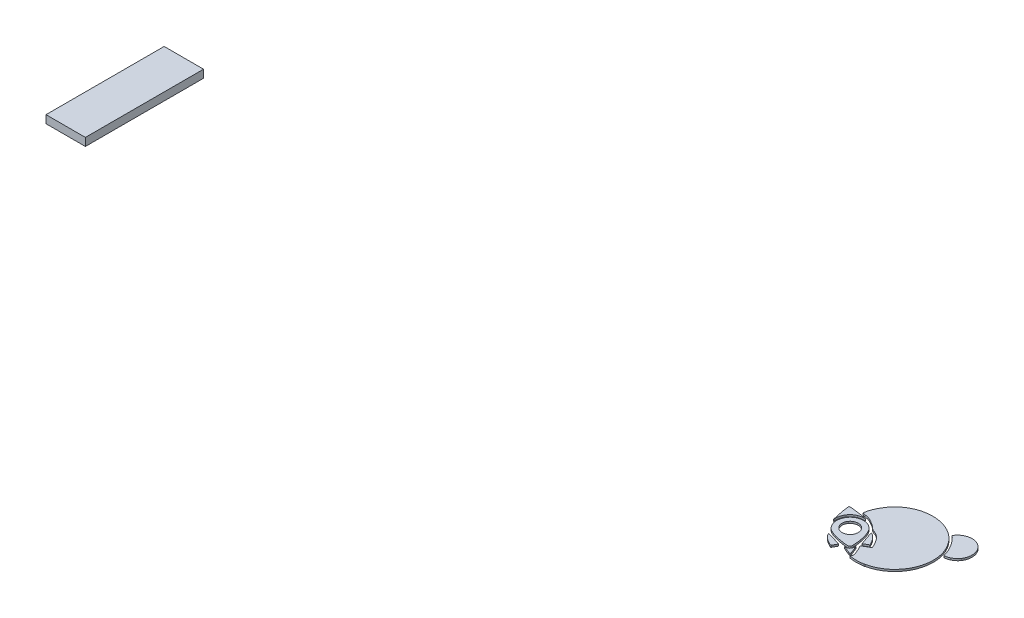
from build123d import *

# Parameters (mm, degrees)
SALIENTE_EXTRUIR1_DEPTH    = 0.3
SALIENTE_EXTRUIR1_2_DEPTH  = 0.3
SALIENTE_EXTRUIR1_3_DEPTH  = 0.3
SALIENTE_EXTRUIR1_4_DEPTH  = 0.3
SALIENTE_EXTRUIR1_5_DEPTH  = 0.3
SALIENTE_EXTRUIR1_6_DEPTH  = 0.3
SALIENTE_EXTRUIR1_7_DEPTH  = 0.3
SALIENTE_EXTRUIR1_8_DEPTH  = 0.3
SALIENTE_EXTRUIR1_9_DEPTH  = 0.3
SALIENTE_EXTRUIR1_10_DEPTH = 0.3
SALIENTE_EXTRUIR1_11_DEPTH = 0.3
SALIENTE_EXTRUIR1_12_DEPTH = 0.3
SALIENTE_EXTRUIR1_13_DEPTH = 0.3
SALIENTE_EXTRUIR1_14_DEPTH = 0.3
SALIENTE_EXTRUIR1_15_DEPTH = 0.3
SALIENTE_EXTRUIR1_16_DEPTH = 0.3
SALIENTE_EXTRUIR1_17_DEPTH = 0.3
SALIENTE_EXTRUIR1_18_DEPTH = 0.3
CROQUIS3_W                 = 32.379620454
CROQUIS3_H                 = 8.703750059
CORTAR_EXTRUIR2_DEPTH      = 10
SALIENTE_EXTRUIR2_DEPTH    = 0.3
ESCALA2_SCALE              = 0.8
CROQUIS6_W                 = 5
CROQUIS6_H                 = 15
SALIENTE_EXTRUIR3_DEPTH    = 1


with BuildPart() as part:
    # Croquis1 → Saliente-Extruir1 (new body)
    with BuildSketch(Plane(origin=(0, 0, 0), x_dir=(1, 0, 0), z_dir=(0, 1, 0))):
        with BuildLine():
            Line((3.578406282, 3.929124777), (1.831381085, 3.929124777))
            add(Edge.make_bspline(
                [(1.831381085, 3.929124777), (2.195955538, 4.293699449), (2.561850832, 4.656953063), (2.925104228, 5.022805122)],
                knots=[0, 0, 0, 0, 1, 1, 1, 1], degree=3))
            add(Edge.make_bspline(
                [(2.925104228, 5.022805122), (3.050477873, 5.149089533), (3.225876383, 5.406839742), (3.393761239, 5.468737315)],
                knots=[0, 0, 0, 0, 1, 1, 1, 1], degree=3))
            add(Edge.make_bspline(
                [(3.393761239, 5.468737315), (3.539659104, 5.52252512), (3.778106582, 5.477296898), (3.933492482, 5.477296898)],
                knots=[0, 0, 0, 0, 1, 1, 1, 1], degree=3))
            Line((3.933492482, 5.477296898), (5.154989666, 5.477296898))
            Line((5.154989666, 5.477296898), (5.154989666, 2.480368276))
            Line((5.154989666, 2.480368276), (5.169193769, 2.480368276))
            add(Edge.make_bspline(
                [(5.169193769, 2.480368276), (5.184873963, 2.677469913), (5.263674964, 2.886373947), (5.350372835, 3.062709863)],
                knots=[0, 0, 0, 0, 1, 1, 1, 1], degree=3))
            add(Edge.make_bspline(
                [(5.350372835, 3.062709863), (5.429102652, 3.222826461), (5.527291326, 3.374887662), (5.652324117, 3.503017188)],
                knots=[0, 0, 0, 0, 1, 1, 1, 1], degree=3))
            add(Edge.make_bspline(
                [(5.652324117, 3.503017188), (6.163520725, 4.026898354), (6.976569044, 4.092033938), (7.66900171, 4.026131922)],
                knots=[0, 0, 0, 0, 1, 1, 1, 1], degree=3))
            add(Edge.make_bspline(
                [(7.66900171, 4.026131922), (7.927561368, 4.001529673), (8.175738383, 3.943324513), (8.435988121, 3.943324513)],
                knots=[0, 0, 0, 0, 1, 1, 1, 1], degree=3))
            add(Edge.make_bspline(
                [(8.435988121, 3.943324513), (8.421102745, 4.664846657), (8.194841973, 5.406920534), (7.900603268, 6.059638484)],
                knots=[0, 0, 0, 0, 1, 1, 1, 1], degree=3))
            add(Edge.make_bspline(
                [(7.900603268, 6.059638484), (7.603907177, 6.717756614), (7.184706429, 7.310922142), (6.674759913, 7.820867784)],
                knots=[0, 0, 0, 0, 1, 1, 1, 1], degree=3))
            add(Edge.make_bspline(
                [(6.674759913, 7.820867784), (4.340535784, 10.155095188), (0.329636401, 10.188178411), (-1.988793551, 7.792404989)],
                knots=[0, 0, 0, 0, 1, 1, 1, 1], degree=3))
            add(Edge.make_bspline(
                [(-1.988793551, 7.792404989), (-2.582355833, 7.179041248), (-3.048016117, 6.446839277), (-3.346856689, 5.647739365)],
                knots=[0, 0, 0, 0, 1, 1, 1, 1], degree=3))
            add(Edge.make_bspline(
                [(-3.346856689, 5.647739365), (-3.449590458, 5.373001005), (-3.543901117, 5.085311909), (-3.59318728, 4.79553314)],
                knots=[0, 0, 0, 0, 1, 1, 1, 1], degree=3))
            add(Edge.make_bspline(
                [(-3.59318728, 4.79553314), (-3.604421732, 4.72948679), (-3.66630664, 4.565535848), (-3.622290079, 4.507599266)],
                knots=[0, 0, 0, 0, 1, 1, 1, 1], degree=3))
            add(Edge.make_bspline(
                [(-3.622290079, 4.507599266), (-3.566200576, 4.433755617), (-3.326460645, 4.433897549), (-3.239251383, 4.417564468)],
                knots=[0, 0, 0, 0, 1, 1, 1, 1], degree=3))
            add(Edge.make_bspline(
                [(-3.239251383, 4.417564468), (-2.921363774, 4.357994578), (-2.57941566, 4.304986306), (-2.28761993, 4.159089096)],
                knots=[0, 0, 0, 0, 1, 1, 1, 1], degree=3))
            add(Edge.make_bspline(
                [(-2.28761993, 4.159089096), (-1.838094895, 3.934334767), (-1.38344219, 3.663913319), (-0.980902058, 3.362474084)],
                knots=[0, 0, 0, 0, 1, 1, 1, 1], degree=3))
            add(Edge.make_bspline(
                [(-0.980902058, 3.362474084), (-0.821809334, 3.243336705), (-0.708252716, 3.076018703), (-0.540594951, 2.969478104)],
                knots=[0, 0, 0, 0, 1, 1, 1, 1], degree=3))
            add(Edge.make_bspline(
                [(-0.540594951, 2.969478104), (-0.333579702, 2.837927147), (-0.07820172, 2.799577161), (0.141170772, 2.689898776)],
                knots=[0, 0, 0, 0, 1, 1, 1, 1], degree=3))
            add(Edge.make_bspline(
                [(0.141170772, 2.689898776), (0.511298691, 2.504826409), (0.835989639, 2.197777591), (1.084322779, 1.869620448)],
                knots=[0, 0, 0, 0, 1, 1, 1, 1], degree=3))
            add(Edge.make_bspline(
                [(1.084322779, 1.869620448), (1.33001424, 1.544943912), (1.540693951, 1.189459429), (1.707897098, 0.81856333)],
                knots=[0, 0, 0, 0, 1, 1, 1, 1], degree=3))
            add(Edge.make_bspline(
                [(1.707897098, 0.81856333), (1.743135938, 0.740374165), (1.885795355, 0.518871167), (1.824251739, 0.44045491)],
                knots=[0, 0, 0, 0, 1, 1, 1, 1], degree=3))
            add(Edge.make_bspline(
                [(1.824251739, 0.44045491), (1.764753469, 0.3646502), (1.629991141, 0.314227271), (1.54731278, 0.266761111)],
                knots=[0, 0, 0, 0, 1, 1, 1, 1], degree=3))
            add(Edge.make_bspline(
                [(1.54731278, 0.266761111), (1.356759223, 0.157364406), (1.168165855, 0.044375734), (0.979174641, -0.06768929)],
                knots=[0, 0, 0, 0, 1, 1, 1, 1], degree=3))
            add(Edge.make_bspline(
                [(0.979174641, -0.06768929), (0.905629267, -0.111292938), (0.712476174, -0.17778015), (0.702647503, -0.275315719)],
                knots=[0, 0, 0, 0, 1, 1, 1, 1], degree=3))
            add(Edge.make_bspline(
                [(0.702647503, -0.275315719), (0.693756018, -0.363531824), (0.792825324, -0.48487264), (0.832751191, -0.559170471)],
                knots=[0, 0, 0, 0, 1, 1, 1, 1], degree=3))
            add(Edge.make_bspline(
                [(0.832751191, -0.559170471), (0.941933251, -0.762395048), (1.029199287, -0.984238683), (1.114831795, -1.198326505)],
                knots=[0, 0, 0, 0, 1, 1, 1, 1], degree=3))
            add(Edge.make_bspline(
                [(1.114831795, -1.198326505), (1.212949285, -1.443619465), (1.394554802, -1.782002251), (1.387396196, -2.050532731)],
                knots=[0, 0, 0, 0, 1, 1, 1, 1], degree=3))
            add(Edge.make_bspline(
                [(1.387396196, -2.050532731), (1.383277989, -2.204755882), (1.259564946, -2.307446852), (1.249039498, -2.448225563)],
                knots=[0, 0, 0, 0, 1, 1, 1, 1], degree=3))
            add(Edge.make_bspline(
                [(1.249039498, -2.448225563), (1.825884173, -2.555320788), (2.428281167, -2.569708311), (3.010267706, -2.507398044)],
                knots=[0, 0, 0, 0, 1, 1, 1, 1], degree=3))
            add(Edge.make_bspline(
                [(3.010267706, -2.507398044), (3.148538372, -2.49259346), (3.284877454, -2.477129439), (3.422167917, -2.454105909)],
                knots=[0, 0, 0, 0, 1, 1, 1, 1], degree=3))
            add(Edge.make_bspline(
                [(3.422167917, -2.454105909), (3.463372044, -2.447184002), (3.535980231, -2.44794825), (3.563804769, -2.411454295)],
                knots=[0, 0, 0, 0, 1, 1, 1, 1], degree=3))
            add(Edge.make_bspline(
                [(3.563804769, -2.411454295), (3.6257744, -2.330182151), (3.578406282, -2.066466219), (3.578406282, -1.965308331)],
                knots=[0, 0, 0, 0, 1, 1, 1, 1], degree=3))
            add(Edge.make_bspline(
                [(3.578406282, -1.965308331), (3.578406282, -1.558223977), (3.582638034, -1.150556611), (3.578463054, -0.74381071)],
                knots=[0, 0, 0, 0, 1, 1, 1, 1], degree=3))
            add(Edge.make_bspline(
                [(3.578463054, -0.74381071), (3.562442224, 0.813455967), (3.578406282, 2.371759839), (3.578406282, 3.929124777)],
                knots=[0, 0, 0, 0, 1, 1, 1, 1], degree=3))
        make_face()
    extrude(amount=SALIENTE_EXTRUIR1_DEPTH)


with BuildPart() as body_2:
    # Croquis1 → Saliente-Extruir1 2 (new body)
    with BuildSketch(Plane(origin=(0, 0, 0), x_dir=(1, 0, 0), z_dir=(0, 1, 0))):
        with BuildLine():
            Line((3.038675476, 4.426241963), (4.075527835, 4.426241963))
            Line((4.075527835, 4.426241963), (4.075527835, -0.829037512))
            Line((4.075527835, -0.829037512), (4.075527835, -2.078940937))
            add(Edge.make_bspline(
                [(4.075527835, -2.078940937), (4.075527835, -2.159346423), (4.032391907, -2.438244478), (4.098295888, -2.490442647)],
                knots=[0, 0, 0, 0, 1, 1, 1, 1], degree=3))
            add(Edge.make_bspline(
                [(4.098295888, -2.490442647), (4.135480505, -2.519901148), (4.215829437, -2.50505071), (4.260172659, -2.50505071)],
                knots=[0, 0, 0, 0, 1, 1, 1, 1], degree=3))
            Line((4.260172659, -2.50505071), (4.657869422, -2.50505071))
            Line((4.657869422, -2.50505071), (4.657869422, 4.980170977))
            Line((4.657869422, 4.980170977), (3.919289689, 4.980170977))
            Line((3.919289689, 4.980170977), (3.592610385, 4.971611394))
            Line((3.592610385, 4.971611394), (3.407965342, 4.809735059))
            Line((3.407965342, 4.809735059), (3.038675476, 4.426241963))
        make_face()
    extrude(amount=SALIENTE_EXTRUIR1_2_DEPTH)


with BuildPart() as body_3:
    # Croquis1 → Saliente-Extruir1 3 (new body)
    with BuildSketch(Plane(origin=(0, 0, 0), x_dir=(1, 0, 0), z_dir=(0, 1, 0))):
        with BuildLine():
            Line((18.63406794, 4.809735059), (18.63406794, 0.733343079))
            add(Edge.make_bspline(
                [(18.63406794, 0.733343079), (18.63406794, 0.008298841), (18.545581291, -0.783842043), (18.690882169, -1.49659935)],
                knots=[0, 0, 0, 0, 1, 1, 1, 1], degree=3))
            add(Edge.make_bspline(
                [(18.690882169, -1.49659935), (18.793005412, -1.996943849), (19.118832688, -2.395706629), (19.642512967, -2.474734066)],
                knots=[0, 0, 0, 0, 1, 1, 1, 1], degree=3))
            add(Edge.make_bspline(
                [(19.642512967, -2.474734066), (19.723756943, -2.486983876), (20.010524574, -2.555111166), (20.068190393, -2.482267372)],
                knots=[0, 0, 0, 0, 1, 1, 1, 1], degree=3))
            add(Edge.make_bspline(
                [(20.068190393, -2.482267372), (20.095744825, -2.44748315), (20.082820292, -2.375925696), (20.082820292, -2.33459514)],
                knots=[0, 0, 0, 0, 1, 1, 1, 1], degree=3))
            Line((20.082820292, -2.33459514), (20.082820292, -1.936897941))
            add(Edge.make_bspline(
                [(20.082820292, -1.936897941), (19.934820307, -1.936897941), (19.784263365, -1.944016369), (19.642512967, -1.893008245)],
                knots=[0, 0, 0, 0, 1, 1, 1, 1], degree=3))
            add(Edge.make_bspline(
                [(19.642512967, -1.893008245), (19.174367347, -1.724498016), (19.216409745, -1.115468873), (19.216409745, -0.71540032)],
                knots=[0, 0, 0, 0, 1, 1, 1, 1], degree=3))
            Line((19.216409745, -0.71540032), (19.216409745, 2.878074209))
            Line((19.216409745, 2.878074209), (20.082820292, 2.878074209))
            Line((20.082820292, 2.878074209), (20.082820292, 3.275771409))
            Line((20.082820292, 3.275771409), (20.068190393, 3.42344364))
            Line((20.068190393, 3.42344364), (19.855565561, 3.446211693))
            Line((19.855565561, 3.446211693), (19.216409745, 3.446211693))
            Line((19.216409745, 3.446211693), (19.216409745, 4.809743794))
            Line((19.216409745, 4.809743794), (18.63406794, 4.809735059))
        make_face()
    extrude(amount=SALIENTE_EXTRUIR1_3_DEPTH)


with BuildPart() as body_4:
    # Croquis1 → Saliente-Extruir1 4 (new body)
    with BuildSketch(Plane(origin=(0, 0, 0), x_dir=(1, 0, 0), z_dir=(0, 1, 0))):
        with BuildLine():
            Line((23.889347415, 4.809743794), (23.889347415, 0.804370145))
            add(Edge.make_bspline(
                [(23.889347415, 0.804370145), (23.889347415, 0.086455253), (23.82088604, -0.67162417), (23.921871645, -1.382962158)],
                knots=[0, 0, 0, 0, 1, 1, 1, 1], degree=3))
            add(Edge.make_bspline(
                [(23.921871645, -1.382962158), (23.977408269, -1.775148035), (24.15892819, -2.172987166), (24.528501047, -2.357745317)],
                knots=[0, 0, 0, 0, 1, 1, 1, 1], degree=3))
            add(Edge.make_bspline(
                [(24.528501047, -2.357745317), (24.773512327, -2.480265041), (25.054172739, -2.505035425), (25.323895446, -2.505035425)],
                knots=[0, 0, 0, 0, 1, 1, 1, 1], degree=3))
            Line((25.323895446, -2.505035425), (25.323895446, -1.936897941))
            add(Edge.make_bspline(
                [(25.323895446, -1.936897941), (25.180439464, -1.936897941), (25.035138586, -1.942444201), (24.897792224, -1.893008245)],
                knots=[0, 0, 0, 0, 1, 1, 1, 1], degree=3))
            add(Edge.make_bspline(
                [(24.897792224, -1.893008245), (24.430356263, -1.724753493), (24.471689002, -1.129629305), (24.471689002, -0.729604423)],
                knots=[0, 0, 0, 0, 1, 1, 1, 1], degree=3))
            Line((24.471689002, -0.729604423), (24.471689002, 2.878074209))
            Line((24.471689002, 2.878074209), (25.323895446, 2.878074209))
            Line((25.323895446, 2.878074209), (25.323895446, 3.446211693))
            Line((25.323895446, 3.446211693), (24.471689002, 3.446211693))
            Line((24.471689002, 3.446211693), (24.471689002, 4.809743794))
            Line((24.471689002, 4.809743794), (23.889347415, 4.809743794))
        make_face()
    extrude(amount=SALIENTE_EXTRUIR1_4_DEPTH)


with BuildPart() as body_5:
    # Croquis1 → Saliente-Extruir1 5 (new body)
    with BuildSketch(Plane(origin=(0, 0, 0), x_dir=(1, 0, 0), z_dir=(0, 1, 0))):
        with BuildLine():
            Line((-5.099902854, 1.301487332), (-5.085700498, 1.301487332))
            add(Edge.make_bspline(
                [(-5.085700498, 1.301487332), (-5.211824417, 2.29946412), (-4.694224936, 3.292242054), (-3.750575948, 3.695806498)],
                knots=[0, 0, 0, 0, 1, 1, 1, 1], degree=3))
            add(Edge.make_bspline(
                [(-3.750575948, 3.695806498), (-3.393032361, 3.848706189), (-3.039678822, 3.872312731), (-2.656910015, 3.872312731)],
                knots=[0, 0, 0, 0, 1, 1, 1, 1], degree=3))
            add(Edge.make_bspline(
                [(-2.656910015, 3.872312731), (-2.840816138, 3.970813437), (-3.106577199, 3.987814689), (-3.310268841, 4.028549131)],
                knots=[0, 0, 0, 0, 1, 1, 1, 1], degree=3))
            add(Edge.make_bspline(
                [(-3.310268841, 4.028549131), (-3.835541159, 4.133585034), (-4.368431941, 4.201845521), (-4.901055892, 4.253390803)],
                knots=[0, 0, 0, 0, 1, 1, 1, 1], degree=3))
            add(Edge.make_bspline(
                [(-4.901055892, 4.253390803), (-5.071193097, 4.269854897), (-5.242778007, 4.274418552), (-5.412380238, 4.29436762)],
                knots=[0, 0, 0, 0, 1, 1, 1, 1], degree=3))
            add(Edge.make_bspline(
                [(-5.412380238, 4.29436762), (-5.478458687, 4.302141119), (-5.569636801, 4.304346521), (-5.608685965, 4.238562199)],
                knots=[0, 0, 0, 0, 1, 1, 1, 1], degree=3))
            add(Edge.make_bspline(
                [(-5.608685965, 4.238562199), (-5.647504108, 4.173168736), (-5.621132297, 4.070648302), (-5.613583706, 4.000143108)],
                knots=[0, 0, 0, 0, 1, 1, 1, 1], degree=3))
            add(Edge.make_bspline(
                [(-5.613583706, 4.000143108), (-5.593783121, 3.815199354), (-5.573445815, 3.630312591), (-5.546194026, 3.446207326)],
                knots=[0, 0, 0, 0, 1, 1, 1, 1], degree=3))
            add(Edge.make_bspline(
                [(-5.546194026, 3.446207326), (-5.438327346, 2.717470676), (-5.248563586, 2.019812734), (-5.099902854, 1.301487332)],
                knots=[0, 0, 0, 0, 1, 1, 1, 1], degree=3))
        make_face()
    extrude(amount=SALIENTE_EXTRUIR1_5_DEPTH)


with BuildPart() as body_6:
    # Croquis1 → Saliente-Extruir1 6 (new body)
    with BuildSketch(Plane(origin=(0, 0, 0), x_dir=(1, 0, 0), z_dir=(0, 1, 0))):
        with BuildLine():
            Line((5.595298301, -2.505039792), (6.16343644, -2.505039792))
            add(Edge.make_bspline(
                [(6.16343644, -2.505039792), (6.16343644, -1.089766107), (6.146662278, 0.326632115), (6.163493212, 1.741792473)],
                knots=[0, 0, 0, 0, 1, 1, 1, 1], degree=3))
            add(Edge.make_bspline(
                [(6.163493212, 1.741792473), (6.16898925, 2.204612155), (6.291054574, 2.919302137), (6.873609058, 2.962012489)],
                knots=[0, 0, 0, 0, 1, 1, 1, 1], degree=3))
            add(Edge.make_bspline(
                [(6.873609058, 2.962012489), (7.500237313, 3.007946003), (7.726938511, 2.380834743), (7.739806707, 1.855420712)],
                knots=[0, 0, 0, 0, 1, 1, 1, 1], degree=3))
            add(Edge.make_bspline(
                [(7.739806707, 1.855420712), (7.775372209, 0.403899816), (7.740019824, -1.053034143), (7.740019824, -2.505039792)],
                knots=[0, 0, 0, 0, 1, 1, 1, 1], degree=3))
            Line((7.740019824, -2.505039792), (8.308157962, -2.505039792))
            Line((8.308157962, -2.505039792), (8.308157962, 1.585556074))
            add(Edge.make_bspline(
                [(8.308157962, 1.585556074), (8.308157962, 2.198775481), (8.285290557, 2.929117271), (7.725816376, 3.317822541)],
                knots=[0, 0, 0, 0, 1, 1, 1, 1], degree=3))
            add(Edge.make_bspline(
                [(7.725816376, 3.317822541), (6.987364599, 3.830866447), (5.919236355, 3.435754591), (5.693074717, 2.579796779)],
                knots=[0, 0, 0, 0, 1, 1, 1, 1], degree=3))
            add(Edge.make_bspline(
                [(5.693074717, 2.579796779), (5.531340096, 1.967656054), (5.595298301, 1.304312867), (5.595298301, 0.676533217)],
                knots=[0, 0, 0, 0, 1, 1, 1, 1], degree=3))
            Line((5.595298301, 0.676533217), (5.595298301, -2.505039792))
        make_face()
    extrude(amount=SALIENTE_EXTRUIR1_6_DEPTH)


with BuildPart() as body_7:
    # Croquis1 → Saliente-Extruir1 7 (new body)
    with BuildSketch(Plane(origin=(0, 0, 0), x_dir=(1, 0, 0), z_dir=(0, 1, 0))):
        with BuildLine():
            Line((12.824857486, 0.026684474), (13.946930752, 0.587804192))
            add(Edge.make_bspline(
                [(13.946930752, 0.587804192), (14.084702691, 0.656719531), (14.333548533, 0.726146042), (14.435529626, 0.841820502)],
                knots=[0, 0, 0, 0, 1, 1, 1, 1], degree=3))
            add(Edge.make_bspline(
                [(14.435529626, 0.841820502), (14.511517756, 0.92800589), (14.458254007, 1.23161974), (14.458254007, 1.344097457)],
                knots=[0, 0, 0, 0, 1, 1, 1, 1], degree=3))
            add(Edge.make_bspline(
                [(14.458254007, 1.344097457), (14.458254007, 1.85390095), (14.475875392, 2.394938402), (14.24136707, 2.863865739)],
                knots=[0, 0, 0, 0, 1, 1, 1, 1], degree=3))
            add(Edge.make_bspline(
                [(14.24136707, 2.863865739), (13.81668535, 3.713218043), (12.481275627, 3.769278941), (11.993244699, 2.949087956)],
                knots=[0, 0, 0, 0, 1, 1, 1, 1], degree=3))
            add(Edge.make_bspline(
                [(11.993244699, 2.949087956), (11.716845518, 2.484464647), (11.731191116, 1.922006403), (11.731191116, 1.400909503)],
                knots=[0, 0, 0, 0, 1, 1, 1, 1], degree=3))
            Line((11.731191116, 1.400909503), (11.731191116, -0.317707488))
            add(Edge.make_bspline(
                [(11.731191116, -0.317707488), (11.731191116, -0.761381873), (11.713720397, -1.207525873), (11.836722689, -1.638629463)],
                knots=[0, 0, 0, 0, 1, 1, 1, 1], degree=3))
            add(Edge.make_bspline(
                [(11.836722689, -1.638629463), (12.044377286, -2.366612783), (12.738927575, -2.726073541), (13.464013302, -2.549099806)],
                knots=[0, 0, 0, 0, 1, 1, 1, 1], degree=3))
            add(Edge.make_bspline(
                [(13.464013302, -2.549099806), (14.070642704, -2.40101488), (14.362950262, -1.832578029), (14.432121078, -1.255136367)],
                knots=[0, 0, 0, 0, 1, 1, 1, 1], degree=3))
            add(Edge.make_bspline(
                [(14.432121078, -1.255136367), (14.44718769, -1.128341001), (14.458254007, -0.999445043), (14.458254007, -0.871643271)],
                knots=[0, 0, 0, 0, 1, 1, 1, 1], degree=3))
            add(Edge.make_bspline(
                [(14.458254007, -0.871643271), (14.458254007, -0.83447241), (14.468909814, -0.770670767), (14.435529626, -0.744208119)],
                knots=[0, 0, 0, 0, 1, 1, 1, 1], degree=3))
            add(Edge.make_bspline(
                [(14.435529626, -0.744208119), (14.398315312, -0.714751801), (14.317925111, -0.729600056), (14.27360962, -0.729600056)],
                knots=[0, 0, 0, 0, 1, 1, 1, 1], degree=3))
            Line((14.27360962, -0.729600056), (13.87591242, -0.729608791))
            add(Edge.make_bspline(
                [(13.87591242, -0.729608791), (13.87591242, -1.065532881), (13.873641511, -1.416089053), (13.683457196, -1.709645393)],
                knots=[0, 0, 0, 0, 1, 1, 1, 1], degree=3))
            add(Edge.make_bspline(
                [(13.683457196, -1.709645393), (13.441712532, -2.082814585), (12.907804426, -2.152679993), (12.598880141, -1.823217078)],
                knots=[0, 0, 0, 0, 1, 1, 1, 1], degree=3))
            add(Edge.make_bspline(
                [(12.598880141, -1.823217078), (12.443637483, -1.657619727), (12.374322333, -1.432210328), (12.338387372, -1.212526241)],
                knots=[0, 0, 0, 0, 1, 1, 1, 1], degree=3))
            add(Edge.make_bspline(
                [(12.338387372, -1.212526241), (12.300181501, -0.978480617), (12.313531829, -0.738755753), (12.313531829, -0.502351876)],
                knots=[0, 0, 0, 0, 1, 1, 1, 1], degree=3))
            add(Edge.make_bspline(
                [(12.313531829, -0.502351876), (12.313531829, -0.431023696), (12.288534355, -0.300110122), (12.328161728, -0.238026946)],
                knots=[0, 0, 0, 0, 1, 1, 1, 1], degree=3))
            add(Edge.make_bspline(
                [(12.328161728, -0.238026946), (12.403724063, -0.119511666), (12.699725998, -0.03591184), (12.824857486, 0.026684474)],
                knots=[0, 0, 0, 0, 1, 1, 1, 1], degree=3))
        make_face()
        with BuildLine():
            add(Edge.make_bspline(
                [(12.313529646, 0.435074601), (12.313529646, 0.940078832), (12.291934168, 1.450367076), (12.314184716, 1.954845067)],
                knots=[0, 0, 0, 0, 1, 1, 1, 1], degree=3))
            add(Edge.make_bspline(
                [(12.314184716, 1.954845067), (12.321718022, 2.127801038), (12.3607733, 2.30332685), (12.417871393, 2.466170723)],
                knots=[0, 0, 0, 0, 1, 1, 1, 1], degree=3))
            add(Edge.make_bspline(
                [(12.417871393, 2.466170723), (12.593851387, 2.967637357), (13.24848891, 3.155605352), (13.617780087, 2.736035362)],
                knots=[0, 0, 0, 0, 1, 1, 1, 1], degree=3))
            add(Edge.make_bspline(
                [(13.617780087, 2.736035362), (13.862363387, 2.458102444), (13.875997579, 2.03466754), (13.875997579, 1.684980428)],
                knots=[0, 0, 0, 0, 1, 1, 1, 1], degree=3))
            add(Edge.make_bspline(
                [(13.875997579, 1.684980428), (13.875997579, 1.573354301), (13.925710848, 1.303332446), (13.861367681, 1.211109495)],
                knots=[0, 0, 0, 0, 1, 1, 1, 1], degree=3))
            add(Edge.make_bspline(
                [(13.861367681, 1.211109495), (13.79219883, 1.111984289), (13.557415378, 1.046306962), (13.449894358, 0.992519376)],
                knots=[0, 0, 0, 0, 1, 1, 1, 1], degree=3))
            add(Edge.make_bspline(
                [(13.449894358, 0.992519376), (13.088699847, 0.81192092), (12.701230475, 0.546742216), (12.313529646, 0.435074601)],
                knots=[0, 0, 0, 0, 1, 1, 1, 1], degree=3))
        make_face(mode=Mode.SUBTRACT)
    extrude(amount=SALIENTE_EXTRUIR1_7_DEPTH)


with BuildPart() as body_8:
    # Croquis1 → Saliente-Extruir1 8 (new body)
    with BuildSketch(Plane(origin=(0, 0, 0), x_dir=(1, 0, 0), z_dir=(0, 1, 0))):
        with BuildLine():
            Line((17.298946448, -2.505031057), (17.725049669, -2.505031057))
            add(Edge.make_bspline(
                [(17.725049669, -2.505031057), (17.768227523, -2.505031057), (17.849329567, -2.519748299), (17.872765572, -2.472107235)],
                knots=[0, 0, 0, 0, 1, 1, 1, 1], degree=3))
            add(Edge.make_bspline(
                [(17.872765572, -2.472107235), (17.91906811, -2.377853785), (17.881281484, -2.183507592), (17.881281484, -2.078927836)],
                knots=[0, 0, 0, 0, 1, 1, 1, 1], degree=3))
            Line((17.881281484, -2.078927836), (17.881281484, -1.098889049))
            add(Edge.make_bspline(
                [(17.881281484, -1.098889049), (17.881281484, -0.073244284), (17.912528327, 0.959377196), (17.86763419, 1.983259824)],
                knots=[0, 0, 0, 0, 1, 1, 1, 1], degree=3))
            add(Edge.make_bspline(
                [(17.86763419, 1.983259824), (17.846038931, 2.477158432), (17.716793603, 3.045125598), (17.270520773, 3.331310216)],
                knots=[0, 0, 0, 0, 1, 1, 1, 1], degree=3))
            add(Edge.make_bspline(
                [(17.270520773, 3.331310216), (16.580090438, 3.774089339), (15.593376269, 3.492946577), (15.3023485, 2.721839993)],
                knots=[0, 0, 0, 0, 1, 1, 1, 1], degree=3))
            add(Edge.make_bspline(
                [(15.3023485, 2.721839993), (15.128355552, 2.261109767), (15.154206801, 1.756686583), (15.154206801, 1.27308786)],
                knots=[0, 0, 0, 0, 1, 1, 1, 1], degree=3))
            Line((15.154206801, 1.27308786), (15.154206801, -0.786412101))
            Line((15.154206801, -0.786412101), (15.154206801, -2.064723732))
            add(Edge.make_bspline(
                [(15.154206801, -2.064723732), (15.154206801, -2.147118448), (15.109749378, -2.43716798), (15.176931182, -2.490429545)],
                knots=[0, 0, 0, 0, 1, 1, 1, 1], degree=3))
            add(Edge.make_bspline(
                [(15.176931182, -2.490429545), (15.227353892, -2.530299294), (15.362713208, -2.505037608), (15.42407144, -2.505037608)],
                knots=[0, 0, 0, 0, 1, 1, 1, 1], degree=3))
            add(Edge.make_bspline(
                [(15.42407144, -2.505037608), (15.49366827, -2.505037608), (15.657293641, -2.535205769), (15.713821823, -2.490429545)],
                knots=[0, 0, 0, 0, 1, 1, 1, 1], degree=3))
            add(Edge.make_bspline(
                [(15.713821823, -2.490429545), (15.762541569, -2.451824081), (15.736548388, -2.305302589), (15.736548388, -2.249368338)],
                knots=[0, 0, 0, 0, 1, 1, 1, 1], degree=3))
            Line((15.736548388, -2.249368338), (15.736548388, -1.524992271))
            Line((15.736548388, -1.524992271), (15.736548388, 1.102647357))
            add(Edge.make_bspline(
                [(15.736548388, 1.102647357), (15.736548388, 1.566063371), (15.671637493, 2.0888069), (15.868783019, 2.522991503)],
                knots=[0, 0, 0, 0, 1, 1, 1, 1], degree=3))
            add(Edge.make_bspline(
                [(15.868783019, 2.522991503), (16.106263177, 3.045907315), (16.803368676, 3.121753513), (17.113288667, 2.622415639)],
                knots=[0, 0, 0, 0, 1, 1, 1, 1], degree=3))
            add(Edge.make_bspline(
                [(17.113288667, 2.622415639), (17.372360152, 2.205118743), (17.298928979, 1.641156239), (17.298928979, 1.173663505)],
                knots=[0, 0, 0, 0, 1, 1, 1, 1], degree=3))
            Line((17.298928979, 1.173663505), (17.298928979, -0.303494652))
            Line((17.298928979, -0.303494652), (17.298946448, -2.505031057))
        make_face()
    extrude(amount=SALIENTE_EXTRUIR1_8_DEPTH)


with BuildPart() as body_9:
    # Croquis1 → Saliente-Extruir1 9 (new body)
    with BuildSketch(Plane(origin=(0, 0, 0), x_dir=(1, 0, 0), z_dir=(0, 1, 0))):
        with BuildLine():
            Line((20.452096184, 1.244681837), (20.452096184, -0.331902857))
            add(Edge.make_bspline(
                [(20.452096184, -0.331902857), (20.452096184, -0.752311336), (20.43860174, -1.171141097), (20.542569879, -1.5818065)],
                knots=[0, 0, 0, 0, 1, 1, 1, 1], degree=3))
            add(Edge.make_bspline(
                [(20.542569879, -1.5818065), (20.726646757, -2.30814341), (21.344355578, -2.675102537), (22.071288602, -2.571985771)],
                knots=[0, 0, 0, 0, 1, 1, 1, 1], degree=3))
            add(Edge.make_bspline(
                [(22.071288602, -2.571985771), (22.63204148, -2.492460262), (22.974201838, -2.048517298), (23.102885989, -1.524992271)],
                knots=[0, 0, 0, 0, 1, 1, 1, 1], degree=3))
            add(Edge.make_bspline(
                [(23.102885989, -1.524992271), (23.27588323, -0.820316346), (23.179157983, -0.01610252), (23.179157983, 0.704950158)],
                knots=[0, 0, 0, 0, 1, 1, 1, 1], degree=3))
            add(Edge.make_bspline(
                [(23.179157983, 0.704950158), (23.179157983, 1.338538096), (23.257135125, 2.040159211), (23.056013541, 2.650823845)],
                knots=[0, 0, 0, 0, 1, 1, 1, 1], degree=3))
            add(Edge.make_bspline(
                [(23.056013541, 2.650823845), (22.860147584, 3.245266978), (22.301242222, 3.608832842), (21.673591402, 3.525416217)],
                knots=[0, 0, 0, 0, 1, 1, 1, 1], degree=3))
            add(Edge.make_bspline(
                [(21.673591402, 3.525416217), (21.175618476, 3.459212651), (20.793263018, 3.220153775), (20.605633476, 2.736044096)],
                knots=[0, 0, 0, 0, 1, 1, 1, 1], degree=3))
            add(Edge.make_bspline(
                [(20.605633476, 2.736044096), (20.422410591, 2.262898108), (20.452096184, 1.742440992), (20.452096184, 1.244681837)],
                knots=[0, 0, 0, 0, 1, 1, 1, 1], degree=3))
        make_face()
        with BuildLine():
            add(Edge.make_bspline(
                [(21.702102236, 2.959184769), (22.193542149, 3.023187301), (22.478178618, 2.654577397), (22.561979551, 2.210507786)],
                knots=[0, 0, 0, 0, 1, 1, 1, 1], degree=3))
            add(Edge.make_bspline(
                [(22.561979551, 2.210507786), (22.659840471, 1.691328057), (22.596918806, 1.118290431), (22.596918806, 0.591313184)],
                knots=[0, 0, 0, 0, 1, 1, 1, 1], degree=3))
            add(Edge.make_bspline(
                [(22.596918806, 0.591313184), (22.596918806, 0.055503191), (22.660833994, -0.525419077), (22.590957668, -1.056287658)],
                knots=[0, 0, 0, 0, 1, 1, 1, 1], degree=3))
            add(Edge.make_bspline(
                [(22.590957668, -1.056287658), (22.535706873, -1.475899135), (22.411143331, -1.967764843), (21.915157232, -2.032221338)],
                knots=[0, 0, 0, 0, 1, 1, 1, 1], degree=3))
            add(Edge.make_bspline(
                [(21.915157232, -2.032221338), (21.432239781, -2.094972686), (21.150869928, -1.71544058), (21.06948402, -1.283542171)],
                knots=[0, 0, 0, 0, 1, 1, 1, 1], degree=3))
            add(Edge.make_bspline(
                [(21.06948402, -1.283542171), (20.974035941, -0.777559921), (21.034542582, -0.220484169), (21.034542582, 0.293040121)],
                knots=[0, 0, 0, 0, 1, 1, 1, 1], degree=3))
            add(Edge.make_bspline(
                [(21.034542582, 0.293040121), (21.034542582, 0.849362542), (20.97318435, 1.44532522), (21.038669523, 1.997455192)],
                knots=[0, 0, 0, 0, 1, 1, 1, 1], degree=3))
            add(Edge.make_bspline(
                [(21.038669523, 1.997455192), (21.086819358, 2.404428184), (21.22416572, 2.896918392), (21.702102236, 2.959184769)],
                knots=[0, 0, 0, 0, 1, 1, 1, 1], degree=3))
        make_face(mode=Mode.SUBTRACT)
    extrude(amount=SALIENTE_EXTRUIR1_9_DEPTH)


with BuildPart() as body_10:
    # Croquis1 → Saliente-Extruir1 10 (new body)
    with BuildSketch(Plane(origin=(0, 0, 0), x_dir=(1, 0, 0), z_dir=(0, 1, 0))):
        with BuildLine():
            Line((28.420233137, -0.729600056), (27.852095435, -0.729600056))
            add(Edge.make_bspline(
                [(27.852095435, -0.729600056), (27.852095435, -1.064928033), (27.846702025, -1.417615366), (27.657507084, -1.709636659)],
                knots=[0, 0, 0, 0, 1, 1, 1, 1], degree=3))
            add(Edge.make_bspline(
                [(27.657507084, -1.709636659), (27.395027268, -2.115033115), (26.823197155, -2.146352016), (26.524356582, -1.766450888)],
                knots=[0, 0, 0, 0, 1, 1, 1, 1], degree=3))
            add(Edge.make_bspline(
                [(26.524356582, -1.766450888), (26.218412867, -1.377546912), (26.28659016, -0.793698664), (26.289714844, -0.331902857)],
                knots=[0, 0, 0, 0, 1, 1, 1, 1], degree=3))
            add(Edge.make_bspline(
                [(26.289714844, -0.331902857), (26.291024984, -0.143052701), (26.637414911, -0.055007133), (26.786836398, 0.019675225)],
                knots=[0, 0, 0, 0, 1, 1, 1, 1], degree=3))
            Line((26.786836398, 0.019675225), (27.837891332, 0.545202801))
            add(Edge.make_bspline(
                [(27.837891332, 0.545202801), (28.013445748, 0.633008395), (28.211726512, 0.707563887), (28.37549185, 0.815678838)],
                knots=[0, 0, 0, 0, 1, 1, 1, 1], degree=3))
            add(Edge.make_bspline(
                [(28.37549185, 0.815678838), (28.43443724, 0.854596552), (28.420233137, 0.926750339), (28.420233137, 0.989019118)],
                knots=[0, 0, 0, 0, 1, 1, 1, 1], degree=3))
            Line((28.420233137, 0.989019118), (28.420233137, 1.457732247))
            add(Edge.make_bspline(
                [(28.420233137, 1.457732247), (28.420233137, 2.103777435), (28.433159853, 2.894269726), (27.837891332, 3.312136533)],
                knots=[0, 0, 0, 0, 1, 1, 1, 1], degree=3))
            add(Edge.make_bspline(
                [(27.837891332, 3.312136533), (27.405538741, 3.615649939), (26.700336576, 3.615280916), (26.275510741, 3.2968734)],
                knots=[0, 0, 0, 0, 1, 1, 1, 1], degree=3))
            add(Edge.make_bspline(
                [(26.275510741, 3.2968734), (26.063453854, 3.13789444), (25.926533288, 2.911760097), (25.838328319, 2.66501703)],
                knots=[0, 0, 0, 0, 1, 1, 1, 1], degree=3))
            add(Edge.make_bspline(
                [(25.838328319, 2.66501703), (25.682091919, 2.227893346), (25.707373257, 1.757843874), (25.707373257, 1.301487332)],
                knots=[0, 0, 0, 0, 1, 1, 1, 1], degree=3))
            Line((25.707373257, 1.301487332), (25.707373257, -0.644386356))
            add(Edge.make_bspline(
                [(25.707373257, -0.644386356), (25.707373257, -1.133994255), (25.726828839, -1.65746251), (26.010760016, -2.07893657)],
                knots=[0, 0, 0, 0, 1, 1, 1, 1], degree=3))
            add(Edge.make_bspline(
                [(26.010760016, -2.07893657), (26.442544879, -2.71989623), (27.526126227, -2.77463607), (28.032621834, -2.192562844)],
                knots=[0, 0, 0, 0, 1, 1, 1, 1], degree=3))
            add(Edge.make_bspline(
                [(28.032621834, -2.192562844), (28.385719678, -1.786786447), (28.430742645, -1.240733559), (28.420233137, -0.729600056)],
                knots=[0, 0, 0, 0, 1, 1, 1, 1], degree=3))
        make_face()
        with BuildLine():
            add(Edge.make_bspline(
                [(26.289828389, 0.435074601), (26.289828389, 0.949524942), (26.267955599, 1.469342273), (26.29048346, 1.983251089)],
                knots=[0, 0, 0, 0, 1, 1, 1, 1], degree=3))
            add(Edge.make_bspline(
                [(26.29048346, 1.983251089), (26.297732902, 2.147870202), (26.33394736, 2.327686723), (26.395731387, 2.480372643)],
                knots=[0, 0, 0, 0, 1, 1, 1, 1], degree=3))
            add(Edge.make_bspline(
                [(26.395731387, 2.480372643), (26.584780247, 2.947026669), (27.20973196, 3.166158531), (27.579872544, 2.750182693)],
                knots=[0, 0, 0, 0, 1, 1, 1, 1], degree=3))
            add(Edge.make_bspline(
                [(27.579872544, 2.750182693), (27.827724644, 2.471553216), (27.852296323, 2.052535669), (27.852296323, 1.699182347)],
                knots=[0, 0, 0, 0, 1, 1, 1, 1], degree=3))
            add(Edge.make_bspline(
                [(27.852296323, 1.699182347), (27.852296323, 1.584689197), (27.903712774, 1.305590254), (27.837666425, 1.211109495)],
                knots=[0, 0, 0, 0, 1, 1, 1, 1], degree=3))
            add(Edge.make_bspline(
                [(27.837666425, 1.211109495), (27.768495609, 1.111969004), (27.533711938, 1.046306962), (27.426193101, 0.992519376)],
                knots=[0, 0, 0, 0, 1, 1, 1, 1], degree=3))
            add(Edge.make_bspline(
                [(27.426193101, 0.992519376), (27.064998591, 0.81192092), (26.677527036, 0.546742216), (26.289828389, 0.435074601)],
                knots=[0, 0, 0, 0, 1, 1, 1, 1], degree=3))
        make_face(mode=Mode.SUBTRACT)
    extrude(amount=SALIENTE_EXTRUIR1_10_DEPTH)


with BuildPart() as body_11:
    # Croquis1 → Saliente-Extruir1 11 (new body)
    with BuildSketch(Plane(origin=(0, 0, 0), x_dir=(1, 0, 0), z_dir=(0, 1, 0))):
        with BuildLine():
            Line((31.687028581, -0.786420836), (31.118888914, -0.786420836))
            add(Edge.make_bspline(
                [(31.118888914, -0.786420836), (31.118888914, -1.098812625), (31.124719038, -1.452834118), (30.943334497, -1.723849496)],
                knots=[0, 0, 0, 0, 1, 1, 1, 1], degree=3))
            add(Edge.make_bspline(
                [(30.943334497, -1.723849496), (30.672190288, -2.129031963), (30.084166842, -2.117526749), (29.822115006, -1.709634475)],
                knots=[0, 0, 0, 0, 1, 1, 1, 1], degree=3))
            add(Edge.make_bspline(
                [(29.822115006, -1.709634475), (29.634911478, -1.418335943), (29.655932677, -1.01848138), (29.655932677, -0.686987747)],
                knots=[0, 0, 0, 0, 1, 1, 1, 1], degree=3))
            Line((29.655932677, -0.686987747), (29.655932677, 1.358310295))
            add(Edge.make_bspline(
                [(29.655932677, 1.358310295), (29.655932677, 1.729673676), (29.609914003, 2.157014981), (29.753369767, 2.508791767)],
                knots=[0, 0, 0, 0, 1, 1, 1, 1], degree=3))
            add(Edge.make_bspline(
                [(29.753369767, 2.508791767), (29.948665813, 2.987219586), (30.575890618, 3.142562906), (30.91251345, 2.707640257)],
                knots=[0, 0, 0, 0, 1, 1, 1, 1], degree=3))
            add(Edge.make_bspline(
                [(30.91251345, 2.707640257), (31.123860896, 2.434635649), (31.118888914, 2.05494851), (31.118888914, 1.727601471)],
                knots=[0, 0, 0, 0, 1, 1, 1, 1], degree=3))
            Line((31.118888914, 1.727601471), (31.687028581, 1.727601471))
            add(Edge.make_bspline(
                [(31.687028581, 1.727601471), (31.687028581, 2.224465146), (31.662882698, 2.7337448), (31.325692139, 3.133743479)],
                knots=[0, 0, 0, 0, 1, 1, 1, 1], degree=3))
            add(Edge.make_bspline(
                [(31.325692139, 3.133743479), (30.839082276, 3.711071596), (29.791575638, 3.656146371), (29.368313237, 3.034319125)],
                knots=[0, 0, 0, 0, 1, 1, 1, 1], degree=3))
            add(Edge.make_bspline(
                [(29.368313237, 3.034319125), (29.099584053, 2.639576292), (29.087794975, 2.158248696), (29.087794975, 1.699193265)],
                knots=[0, 0, 0, 0, 1, 1, 1, 1], degree=3))
            Line((29.087794975, 1.699193265), (29.087794975, -0.587563393))
            add(Edge.make_bspline(
                [(29.087794975, -0.587563393), (29.087794975, -1.091530429), (29.067203939, -1.621191497), (29.349707063, -2.064721549)],
                knots=[0, 0, 0, 0, 1, 1, 1, 1], degree=3))
            add(Edge.make_bspline(
                [(29.349707063, -2.064721549), (29.767145891, -2.720311108), (30.846325168, -2.779824225), (31.339610195, -2.178350006)],
                knots=[0, 0, 0, 0, 1, 1, 1, 1], degree=3))
            add(Edge.make_bspline(
                [(31.339610195, -2.178350006), (31.665721335, -1.780510875), (31.687028581, -1.275122337), (31.687028581, -0.786420836)],
                knots=[0, 0, 0, 0, 1, 1, 1, 1], degree=3))
        make_face()
    extrude(amount=SALIENTE_EXTRUIR1_11_DEPTH)


with BuildPart() as body_12:
    # Croquis1 → Saliente-Extruir1 12 (new body)
    with BuildSketch(Plane(origin=(0, 0, 0), x_dir=(1, 0, 0), z_dir=(0, 1, 0))):
        with BuildLine():
            Line((34.485108712, -2.235164235), (34.485108712, -2.505028874))
            Line((34.485108712, -2.505028874), (35.024840392, -2.505028874))
            Line((35.024840392, -2.505028874), (35.024840392, 0.065796526))
            Line((35.024840392, 0.065796526), (35.024840392, 1.869635733))
            add(Edge.make_bspline(
                [(35.024840392, 1.869635733), (35.024840392, 2.329472881), (34.925699901, 2.867427137), (34.582118042, 3.200698193)],
                knots=[0, 0, 0, 0, 1, 1, 1, 1], degree=3))
            add(Edge.make_bspline(
                [(34.582118042, 3.200698193), (34.039971337, 3.726467927), (32.973434913, 3.629314701), (32.576305441, 2.977504896)],
                knots=[0, 0, 0, 0, 1, 1, 1, 1], degree=3))
            add(Edge.make_bspline(
                [(32.576305441, 2.977504896), (32.308713896, 2.538162926), (32.311980512, 2.025048928), (32.311980512, 1.528752763)],
                knots=[0, 0, 0, 0, 1, 1, 1, 1], degree=3))
            Line((32.311980512, 1.528752763), (32.311980512, -0.402916822))
            add(Edge.make_bspline(
                [(32.311980512, -0.402916822), (32.311980512, -0.850525995), (32.284851876, -1.309622695), (32.44052033, -1.738042681)],
                knots=[0, 0, 0, 0, 1, 1, 1, 1], degree=3))
            add(Edge.make_bspline(
                [(32.44052033, -1.738042681), (32.528723333, -1.980567097), (32.670048154, -2.209013837), (32.880117995, -2.364073294)],
                knots=[0, 0, 0, 0, 1, 1, 1, 1], degree=3))
            add(Edge.make_bspline(
                [(32.880117995, -2.364073294), (33.361755876, -2.719487903), (34.070508521, -2.64949148), (34.485108712, -2.235164235)],
                knots=[0, 0, 0, 0, 1, 1, 1, 1], degree=3))
        make_face()
        with BuildLine():
            add(Edge.make_bspline(
                [(33.547880722, 2.959184769), (34.062189131, 3.026170053), (34.347677191, 2.631639026), (34.422246003, 2.167897879)],
                knots=[0, 0, 0, 0, 1, 1, 1, 1], degree=3))
            add(Edge.make_bspline(
                [(34.422246003, 2.167897879), (34.500365295, 1.682395085), (34.456901394, 1.167206698), (34.456901394, 0.676533217)],
                knots=[0, 0, 0, 0, 1, 1, 1, 1], degree=3))
            add(Edge.make_bspline(
                [(34.456901394, 0.676533217), (34.456901394, 0.08926332), (34.49596104, -0.514424817), (34.44028445, -1.098897784)],
                knots=[0, 0, 0, 0, 1, 1, 1, 1], degree=3))
            add(Edge.make_bspline(
                [(34.44028445, -1.098897784), (34.401366736, -1.507274809), (34.240300504, -1.971756404), (33.775135453, -2.032221338)],
                knots=[0, 0, 0, 0, 1, 1, 1, 1], degree=3))
            add(Edge.make_bspline(
                [(33.775135453, -2.032221338), (33.26182275, -2.098920575), (32.976760486, -1.686962499), (32.910572204, -1.226728161)],
                knots=[0, 0, 0, 0, 1, 1, 1, 1], degree=3))
            add(Edge.make_bspline(
                [(32.910572204, -1.226728161), (32.843106535, -0.757346642), (32.880318884, -0.265793184), (32.880318884, 0.207820088)],
                knots=[0, 0, 0, 0, 1, 1, 1, 1], degree=3))
            add(Edge.make_bspline(
                [(32.880318884, 0.207820088), (32.880318884, 0.816523879), (32.853048316, 1.433265379), (32.895800373, 2.040065318)],
                knots=[0, 0, 0, 0, 1, 1, 1, 1], degree=3))
            add(Edge.make_bspline(
                [(32.895800373, 2.040065318), (32.923354805, 2.431157227), (33.108995117, 2.902001736), (33.547880722, 2.959184769)],
                knots=[0, 0, 0, 0, 1, 1, 1, 1], degree=3))
        make_face(mode=Mode.SUBTRACT)
    extrude(amount=SALIENTE_EXTRUIR1_12_DEPTH)


with BuildPart() as body_13:
    # Croquis1 → Saliente-Extruir1 13 (new body)
    with BuildSketch(Plane(origin=(0, 0, 0), x_dir=(1, 0, 0), z_dir=(0, 1, 0))):
        with BuildLine():
            Line((8.663242852, 3.446207326), (8.770904713, 2.821255614))
            Line((8.770904713, 2.821255614), (9.049576769, 1.358299377))
            Line((9.049576769, 1.358299377), (9.785315682, -2.505039792))
            add(Edge.make_bspline(
                [(9.785315682, -2.505039792), (9.892409597, -2.505039792), (10.174348269, -2.555689811), (10.259852821, -2.490431729)],
                knots=[0, 0, 0, 0, 1, 1, 1, 1], degree=3))
            add(Edge.make_bspline(
                [(10.259852821, -2.490431729), (10.326609267, -2.439554619), (10.331722307, -2.215780711), (10.347772398, -2.135744248)],
                knots=[0, 0, 0, 0, 1, 1, 1, 1], degree=3))
            add(Edge.make_bspline(
                [(10.347772398, -2.135744248), (10.413818529, -1.804746285), (10.47702384, -1.472953504), (10.540939465, -1.141501359)],
                knots=[0, 0, 0, 0, 1, 1, 1, 1], degree=3))
            Line((10.540939465, -1.141501359), (11.131803077, 1.912241492))
            add(Edge.make_bspline(
                [(11.131803077, 1.912241492), (11.19401421, 2.234247526), (11.255941261, 2.556338938), (11.319288722, 2.878076393)],
                knots=[0, 0, 0, 0, 1, 1, 1, 1], degree=3))
            add(Edge.make_bspline(
                [(11.319288722, 2.878076393), (11.355791629, 3.063487212), (11.414735709, 3.256741623), (11.418712858, 3.446213877)],
                knots=[0, 0, 0, 0, 1, 1, 1, 1], degree=3))
            Line((11.418712858, 3.446213877), (10.850574719, 3.446213877))
            add(Edge.make_bspline(
                [(10.850574719, 3.446213877), (10.657975816, 2.453379388), (10.470206089, 1.458754157), (10.290674305, 0.463489358)],
                knots=[0, 0, 0, 0, 1, 1, 1, 1], degree=3))
            add(Edge.make_bspline(
                [(10.290674305, 0.463489358), (10.206163931, -0.004898638), (10.042256006, -0.508354501), (10.040977746, -0.985262776)],
                knots=[0, 0, 0, 0, 1, 1, 1, 1], degree=3))
            Line((10.040977746, -0.985262776), (10.026773643, -0.985262776))
            Line((10.026773643, -0.985262776), (9.245584221, 3.446207326))
            Line((9.245584221, 3.446207326), (8.663242852, 3.446207326))
        make_face()
    extrude(amount=SALIENTE_EXTRUIR1_13_DEPTH)


with BuildPart() as body_14:
    # Croquis1 → Saliente-Extruir1 14 (new body)
    with BuildSketch(Plane(origin=(0, 0, 0), x_dir=(1, 0, 0), z_dir=(0, 1, 0))):
        with BuildLine():
            Line((-0.227934584, 2.409356495), (-0.00540924, 1.684980428))
            Line((-0.00540924, 1.684980428), (0.510644931, 0.193615985))
            Line((0.510644931, 0.193615985), (1.306038457, 0.648127413))
            add(Edge.make_bspline(
                [(1.306038457, 0.648127413), (1.09710538, 1.14996307), (0.773423022, 1.66334783), (0.368610233, 2.028263139)],
                knots=[0, 0, 0, 0, 1, 1, 1, 1], degree=3))
            add(Edge.make_bspline(
                [(0.368610233, 2.028263139), (0.19622308, 2.183663014), (-0.000338561, 2.3438211), (-0.227934584, 2.409356495)],
                knots=[0, 0, 0, 0, 1, 1, 1, 1], degree=3))
        make_face()
    extrude(amount=SALIENTE_EXTRUIR1_14_DEPTH)


with BuildPart() as body_15:
    # Croquis1 → Saliente-Extruir1 15 (new body)
    with BuildSketch(Plane(origin=(0, 0, 0), x_dir=(1, 0, 0), z_dir=(0, 1, 0))):
        with BuildLine():
            Line((-0.469393636, -1.581815234), (-0.469393636, -1.596030255))
            add(Edge.make_bspline(
                [(-0.469393636, -1.596030255), (-0.137046666, -1.734400492), (0.185584742, -1.884302364), (0.524848379, -2.007162942)],
                knots=[0, 0, 0, 0, 1, 1, 1, 1], degree=3))
            add(Edge.make_bspline(
                [(0.524848379, -2.007162942), (0.605097959, -2.036223816), (0.809797972, -2.13507826), (0.889621538, -2.088079165)],
                knots=[0, 0, 0, 0, 1, 1, 1, 1], degree=3))
            add(Edge.make_bspline(
                [(0.889621538, -2.088079165), (0.984642729, -2.032103426), (0.866441446, -1.797007724), (0.84205406, -1.723860414)],
                knots=[0, 0, 0, 0, 1, 1, 1, 1], degree=3))
            add(Edge.make_bspline(
                [(0.84205406, -1.723860414), (0.755143073, -1.463142737), (0.652580059, -1.205689493), (0.535927143, -0.956874221)],
                knots=[0, 0, 0, 0, 1, 1, 1, 1], degree=3))
            add(Edge.make_bspline(
                [(0.535927143, -0.956874221), (0.48952438, -0.857875881), (0.453049859, -0.743382731), (0.382813681, -0.658590459)],
                knots=[0, 0, 0, 0, 1, 1, 1, 1], degree=3))
            add(Edge.make_bspline(
                [(0.382813681, -0.658590459), (0.427824638, -1.014699442), (0.332547751, -1.403079361), (-0.043289978, -1.537927722)],
                knots=[0, 0, 0, 0, 1, 1, 1, 1], degree=3))
            add(Edge.make_bspline(
                [(-0.043289978, -1.537927722), (-0.181929666, -1.587667194), (-0.324660268, -1.581815234), (-0.469393636, -1.581815234)],
                knots=[0, 0, 0, 0, 1, 1, 1, 1], degree=3))
        make_face()
    extrude(amount=SALIENTE_EXTRUIR1_15_DEPTH)


with BuildPart() as body_16:
    # Croquis1 → Saliente-Extruir1 16 (new body)
    with BuildSketch(Plane(origin=(0, 0, 0), x_dir=(1, 0, 0), z_dir=(0, 1, 0))):
        with BuildLine():
            Line((-1.733500946, -2.50505071), (-1.307397287, -1.695454391))
            add(Edge.make_bspline(
                [(-1.307397287, -1.695454391), (-1.528076425, -1.685846697), (-1.765373381, -1.568460539), (-1.97495978, -1.50149054)],
                knots=[0, 0, 0, 0, 1, 1, 1, 1], degree=3))
            add(Edge.make_bspline(
                [(-1.97495978, -1.50149054), (-2.484820919, -1.338592078), (-3.035787269, -1.120071833), (-3.565746394, -1.042094473)],
                knots=[0, 0, 0, 0, 1, 1, 1, 1], degree=3))
            add(Edge.make_bspline(
                [(-3.565746394, -1.042094473), (-3.336346526, -1.593088991), (-2.817948733, -1.957550117), (-2.315842533, -2.241208348)],
                knots=[0, 0, 0, 0, 1, 1, 1, 1], degree=3))
            add(Edge.make_bspline(
                [(-2.315842533, -2.241208348), (-2.143696664, -2.33845787), (-1.930943219, -2.475450276), (-1.733500946, -2.50505071)],
                knots=[0, 0, 0, 0, 1, 1, 1, 1], degree=3))
        make_face()
    extrude(amount=SALIENTE_EXTRUIR1_16_DEPTH)


with BuildPart() as body_17:
    # Croquis1 → Saliente-Extruir1 17 (new body)
    with BuildSketch(Plane(origin=(0, 0, 0), x_dir=(1, 0, 0), z_dir=(0, 1, 0))):
        with BuildLine():
            add(Edge.make_bspline(
                [(8.606428842, 5.065402146), (8.907684221, 5.06560085), (9.230954759, 5.142099935), (9.501246285, 5.274987235)],
                knots=[0, 0, 0, 0, 1, 1, 1, 1], degree=3))
            add(Edge.make_bspline(
                [(9.501246285, 5.274987235), (9.876501656, 5.459505194), (10.205737918, 5.721174906), (10.43753818, 6.073846954)],
                knots=[0, 0, 0, 0, 1, 1, 1, 1], degree=3))
            add(Edge.make_bspline(
                [(10.43753818, 6.073846954), (11.145580293, 7.151165832), (10.818190893, 8.668451398), (9.685891327, 9.31621287)],
                knots=[0, 0, 0, 0, 1, 1, 1, 1], degree=3))
            add(Edge.make_bspline(
                [(9.685891327, 9.31621287), (9.450398216, 9.450940916), (9.188202265, 9.550819453), (8.918904917, 9.592403302)],
                knots=[0, 0, 0, 0, 1, 1, 1, 1], degree=3))
            add(Edge.make_bspline(
                [(8.918904917, 9.592403302), (8.213206208, 9.70139823), (7.518770993, 9.493240975), (6.987249307, 9.016319818)],
                knots=[0, 0, 0, 0, 1, 1, 1, 1], degree=3))
            add(Edge.make_bspline(
                [(6.987249307, 9.016319818), (6.856889923, 8.899357054), (6.737794032, 8.763333934), (6.642020165, 8.61626655)],
                knots=[0, 0, 0, 0, 1, 1, 1, 1], degree=3))
            add(Edge.make_bspline(
                [(6.642020165, 8.61626655), (6.615317543, 8.575248245), (6.551089449, 8.500891239), (6.567110935, 8.448234522)],
                knots=[0, 0, 0, 0, 1, 1, 1, 1], degree=3))
            add(Edge.make_bspline(
                [(6.567110935, 8.448234522), (6.598202308, 8.34612438), (6.784423886, 8.236618715), (6.859403863, 8.161755122)],
                knots=[0, 0, 0, 0, 1, 1, 1, 1], degree=3))
            add(Edge.make_bspline(
                [(6.859403863, 8.161755122), (7.082085769, 7.939428701), (7.285678059, 7.70025628), (7.478319542, 7.451583158)],
                knots=[0, 0, 0, 0, 1, 1, 1, 1], degree=3))
            add(Edge.make_bspline(
                [(7.478319542, 7.451583158), (8.009230266, 6.766251234), (8.430533134, 5.917551817), (8.606428842, 5.065402146)],
                knots=[0, 0, 0, 0, 1, 1, 1, 1], degree=3))
        make_face()
    extrude(amount=SALIENTE_EXTRUIR1_17_DEPTH)


with BuildPart() as body_18:
    # Croquis1 → Saliente-Extruir1 18 (new body)
    with BuildSketch(Plane(origin=(0, 0, 0), x_dir=(1, 0, 0), z_dir=(0, 1, 0))):
        with BuildLine():
            add(Edge.make_bspline(
                [(-2.79894515, 3.482795174), (-3.148577236, 3.436322318), (-3.487315726, 3.327552297), (-3.778983499, 3.123491632)],
                knots=[0, 0, 0, 0, 1, 1, 1, 1], degree=3))
            add(Edge.make_bspline(
                [(-3.778983499, 3.123491632), (-4.766701672, 2.432421513), (-4.984004578, 1.020272512), (-4.249298275, 0.065785608)],
                knots=[0, 0, 0, 0, 1, 1, 1, 1], degree=3))
            add(Edge.make_bspline(
                [(-4.249298275, 0.065785608), (-3.855909471, -0.445269286), (-3.257617365, -0.668078057), (-2.65691067, -0.835055423)],
                knots=[0, 0, 0, 0, 1, 1, 1, 1], degree=3))
            add(Edge.make_bspline(
                [(-2.65691067, -0.835055423), (-2.185952397, -0.965966594), (-1.708134012, -1.07138484), (-1.222361766, -1.129507025)],
                knots=[0, 0, 0, 0, 1, 1, 1, 1], degree=3))
            add(Edge.make_bspline(
                [(-1.222361766, -1.129507025), (-0.920907464, -1.165583919), (-0.543095572, -1.246386814), (-0.242323416, -1.193649305)],
                knots=[0, 0, 0, 0, 1, 1, 1, 1], degree=3))
            add(Edge.make_bspline(
                [(-0.242323416, -1.193649305), (0.001876668, -1.15082519), (-0.000864582, -0.926395994), (-0.000864582, -0.729608791)],
                knots=[0, 0, 0, 0, 1, 1, 1, 1], degree=3))
            add(Edge.make_bspline(
                [(-0.000864582, -0.729608791), (-0.000864582, -0.279615163), (-0.054440144, 0.177112586), (-0.137373982, 0.619721391)],
                knots=[0, 0, 0, 0, 1, 1, 1, 1], degree=3))
            add(Edge.make_bspline(
                [(-0.137373982, 0.619721391), (-0.32765765, 1.635225671), (-0.623430311, 2.796939412), (-1.634261758, 3.286304936)],
                knots=[0, 0, 0, 0, 1, 1, 1, 1], degree=3))
            add(Edge.make_bspline(
                [(-1.634261758, 3.286304936), (-1.800854161, 3.36695258), (-1.978610486, 3.421622546), (-2.159789771, 3.457570608)],
                knots=[0, 0, 0, 0, 1, 1, 1, 1], degree=3))
            add(Edge.make_bspline(
                [(-2.159789771, 3.457570608), (-2.361620796, 3.497623777), (-2.594372875, 3.509980583), (-2.79894515, 3.482795174)],
                knots=[0, 0, 0, 0, 1, 1, 1, 1], degree=3))
        make_face()
        with BuildLine():
            add(Edge.make_bspline(
                [(-2.727742743, 2.703581006), (-2.581447032, 2.721071378), (-2.430038281, 2.703666166), (-2.287435637, 2.66993224)],
                knots=[0, 0, 0, 0, 1, 1, 1, 1], degree=3))
            add(Edge.make_bspline(
                [(-2.287435637, 2.66993224), (-1.193499814, 2.411144836), (-0.973090565, 0.885524595), (-1.932349436, 0.313679196)],
                knots=[0, 0, 0, 0, 1, 1, 1, 1], degree=3))
            add(Edge.make_bspline(
                [(-1.932349436, 0.313679196), (-2.084425486, 0.223017714), (-2.253617207, 0.162482687), (-2.429470117, 0.140865374)],
                knots=[0, 0, 0, 0, 1, 1, 1, 1], degree=3))
            add(Edge.make_bspline(
                [(-2.429470117, 0.140865374), (-3.533490306, 0.00520691), (-4.32352776, 1.293630858), (-3.63341164, 2.196303683)],
                knots=[0, 0, 0, 0, 1, 1, 1, 1], degree=3))
            add(Edge.make_bspline(
                [(-3.63341164, 2.196303683), (-3.536757141, 2.322727843), (-3.418158448, 2.434054821), (-3.281677434, 2.516591468)],
                knots=[0, 0, 0, 0, 1, 1, 1, 1], degree=3))
            add(Edge.make_bspline(
                [(-3.281677434, 2.516591468), (-3.111860995, 2.61928222), (-2.924531475, 2.680031237), (-2.727742743, 2.703581006)],
                knots=[0, 0, 0, 0, 1, 1, 1, 1], degree=3))
        make_face(mode=Mode.SUBTRACT)
    extrude(amount=SALIENTE_EXTRUIR1_18_DEPTH)


with BuildPart() as cortar_extruir2_tool:
    # Croquis3 → Cortar-Extruir2 (new body)
    with BuildSketch(Plane(origin=(0, 0.3, 0), x_dir=(1, 0, 0), z_dir=(0, 1, 0))):
        with Locations((20.109099916, 0.628295948)):
            Rectangle(CROQUIS3_W, CROQUIS3_H)
    extrude(amount=-CORTAR_EXTRUIR2_DEPTH)


with BuildPart() as part_1:
    add(part.part)

    # Cortar-Extruir2: cut by cortar_extruir2_tool
    add(cortar_extruir2_tool.part, mode=Mode.SUBTRACT)



with BuildPart() as body_2_1:
    add(body_2.part)

    # Cortar-Extruir2: cut by cortar_extruir2_tool
    add(cortar_extruir2_tool.part, mode=Mode.SUBTRACT)


with BuildPart() as body_3_1:
    add(body_3.part)

    # Cortar-Extruir2: cut by cortar_extruir2_tool
    add(cortar_extruir2_tool.part, mode=Mode.SUBTRACT)


with BuildPart() as body_4_1:
    add(body_4.part)

    # Cortar-Extruir2: cut by cortar_extruir2_tool
    add(cortar_extruir2_tool.part, mode=Mode.SUBTRACT)


with BuildPart() as body_6_1:
    add(body_6.part)

    # Cortar-Extruir2: cut by cortar_extruir2_tool
    add(cortar_extruir2_tool.part, mode=Mode.SUBTRACT)


with BuildPart() as body_7_1:
    add(body_7.part)

    # Cortar-Extruir2: cut by cortar_extruir2_tool
    add(cortar_extruir2_tool.part, mode=Mode.SUBTRACT)


with BuildPart() as body_8_1:
    add(body_8.part)

    # Cortar-Extruir2: cut by cortar_extruir2_tool
    add(cortar_extruir2_tool.part, mode=Mode.SUBTRACT)


with BuildPart() as body_9_1:
    add(body_9.part)

    # Cortar-Extruir2: cut by cortar_extruir2_tool
    add(cortar_extruir2_tool.part, mode=Mode.SUBTRACT)


with BuildPart() as body_10_1:
    add(body_10.part)

    # Cortar-Extruir2: cut by cortar_extruir2_tool
    add(cortar_extruir2_tool.part, mode=Mode.SUBTRACT)


with BuildPart() as body_11_1:
    add(body_11.part)

    # Cortar-Extruir2: cut by cortar_extruir2_tool
    add(cortar_extruir2_tool.part, mode=Mode.SUBTRACT)


with BuildPart() as body_12_1:
    add(body_12.part)

    # Cortar-Extruir2: cut by cortar_extruir2_tool
    add(cortar_extruir2_tool.part, mode=Mode.SUBTRACT)


with BuildPart() as body_13_1:
    add(body_13.part)

    # Cortar-Extruir2: cut by cortar_extruir2_tool
    add(cortar_extruir2_tool.part, mode=Mode.SUBTRACT)


with BuildPart() as part_2:
    add(part_1.part)

    add(body_2_1.part)  # Saliente-Extruir2 merges body 2
    # Croquis4 → Saliente-Extruir2 (add, through all)
    with BuildSketch(Plane(origin=(0, 0.3, 0), x_dir=(1, 0, 0), z_dir=(0, 1, 0))):
        with BuildLine():
            Line((1.249039498, -2.448225563), (3.067929231, -0.422743119))
            Line((3.067929231, -0.422743119), (2.310749413, 2.105309389))
            Line((2.310749413, 2.105309389), (0.882217167, 3.592794191))
            Line((0.882217167, 3.592794191), (3.067929231, 6.625783279))
            Line((3.067929231, 6.625783279), (8.285390262, 4.980170977))
            ThreePointArc((8.285390262, 4.980170977), (6.763781119, -0.625221484), (1.249039498, -2.448225563))
        make_face()
    extrude(amount=-SALIENTE_EXTRUIR2_DEPTH)


with BuildPart() as body_5_1:
    # Escala2: scaled about (0, 0, 0)
    add(body_5.part.scale(ESCALA2_SCALE))


with BuildPart() as body_16_1:
    # Escala2: scaled about (0, 0, 0)
    add(body_16.part.scale(ESCALA2_SCALE))


with BuildPart() as body_15_1:
    # Escala2: scaled about (0, 0, 0)
    add(body_15.part.scale(ESCALA2_SCALE))


with BuildPart() as body_14_1:
    # Escala2: scaled about (0, 0, 0)
    add(body_14.part.scale(ESCALA2_SCALE))


with BuildPart() as body_18_1:
    # Escala2: scaled about (0, 0, 0)
    add(body_18.part.scale(ESCALA2_SCALE))


with BuildPart() as body_17_1:
    # Escala2: scaled about (0, 0, 0)
    add(body_17.part.scale(ESCALA2_SCALE))


with BuildPart() as part_3:
    # Escala2: scaled about (0, 0, 0)
    add(part_2.part.scale(ESCALA2_SCALE))


with BuildPart() as body_8_2:
    # Croquis6 → Saliente-Extruir3 (new body)
    with BuildSketch(Plane(origin=(0, -0.5, 0), x_dir=(1, 0, 0), z_dir=(0, 1, 0))):
        with Locations((-95.798473451, 2.761856996)):
            Rectangle(CROQUIS6_W, CROQUIS6_H)
    extrude(amount=SALIENTE_EXTRUIR3_DEPTH)


solid = Compound([body_5_1.part, body_16_1.part, body_15_1.part, body_14_1.part, body_18_1.part, body_17_1.part, part_3.part, body_8_2.part])
